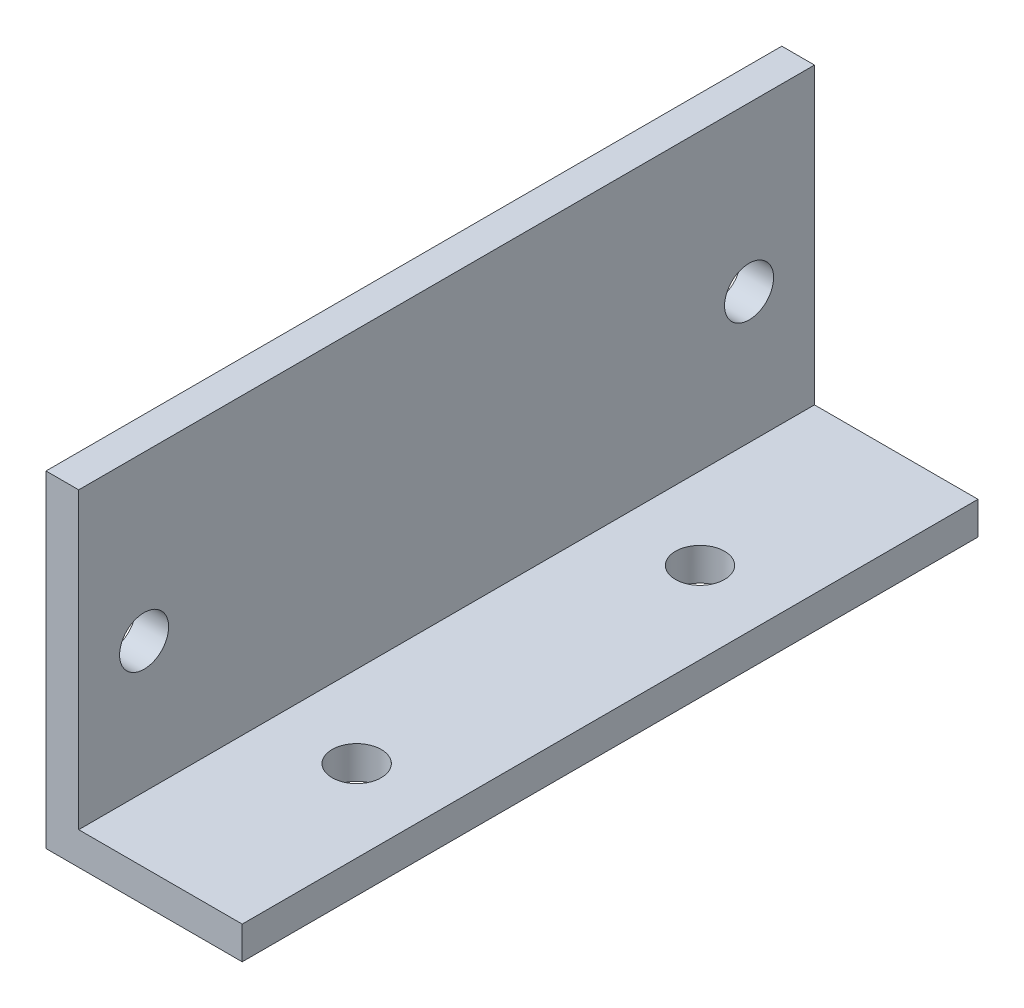
from build123d import *

# Parameters (mm, degrees)
EXTRUDE_1_DEPTH     = 45
SKETCH_2_R          = 1.5
CUT_EXTRUDE_1_DEPTH = 50.309633947
SKETCH_3_R          = 1.5
CUT_EXTRUDE_2_DEPTH = 50.915785078


with BuildPart() as part:
    # 草图1 → 凸台-拉伸1 (new body)
    with BuildSketch(Plane.XY):
        Polygon((-8.16, 16.2), (-6.16, 16.2), (-6.16, -1.8), (3.84, -1.8), (3.84, -3.8), (-8.16, -3.8), align=None)
    extrude(amount=EXTRUDE_1_DEPTH)

    # 草图2 → 切除-拉伸1 (cut, through all)
    with BuildSketch(Plane.ZY.offset(8.16)):
        with Locations((4, 6.2)):
            Circle(SKETCH_2_R)
        with Locations(Location((41, 6.2, 0), (0, 0, 270))):
            Circle(SKETCH_2_R)
    extrude(amount=-CUT_EXTRUDE_1_DEPTH, mode=Mode.SUBTRACT)

    # 草图3 → 切除-拉伸2 (cut, through all)
    with BuildSketch(Plane.XZ.offset(3.8)):
        with Locations((-1.16, 33)):
            Circle(SKETCH_3_R)
        with Locations((-1.16, 12)):
            Circle(SKETCH_3_R)
    extrude(amount=-CUT_EXTRUDE_2_DEPTH, mode=Mode.SUBTRACT)


solid = part.part
